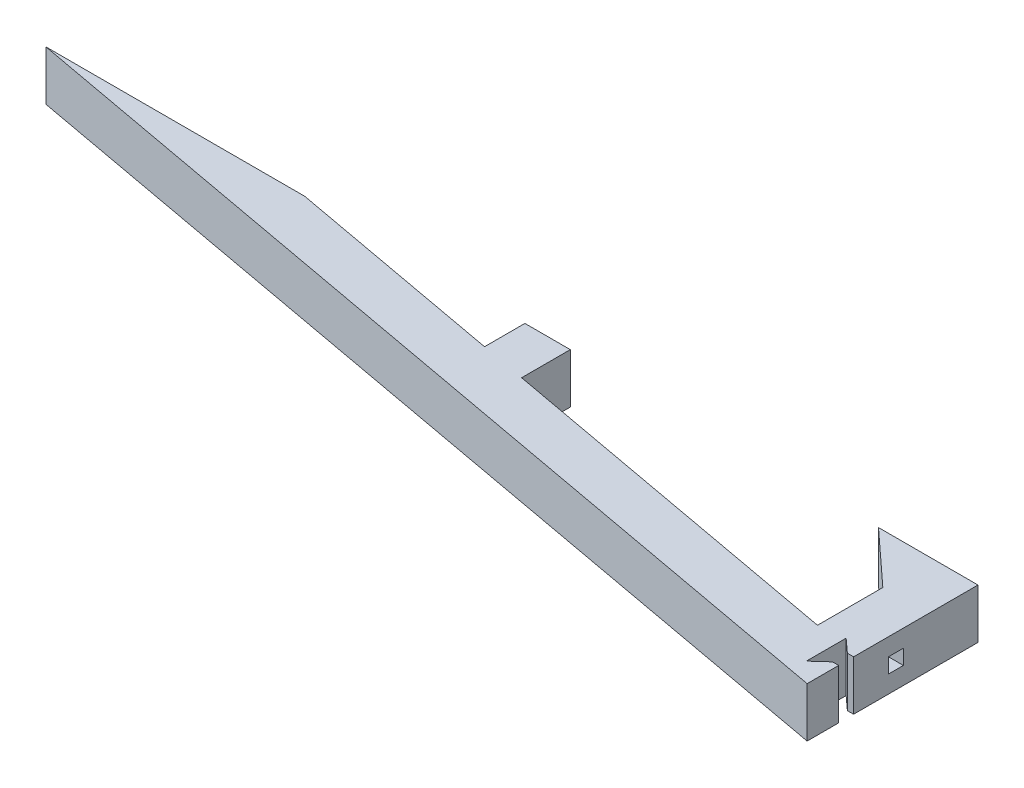
from build123d import *

# Parameters (mm, degrees)
P_IDAT_VYSUNUT_M1_DEPTH  = 8
ODEBRAT_VYSUNUT_M1_DEPTH = 153.557332159
SKICA5_W                 = 16
SKICA5_H                 = 8
P_IDAT_VYSUNUT_M2_DEPTH  = 8
ODEBRAT_VYSUNUT_M4_DEPTH = 153.557332159
SKICA4_W                 = 2.4
SKICA4_H                 = 2.4
ODEBRAT_VYSUNUT_M2_DEPTH = 4.4
SKICA9_R                 = 2.2
ODEBRAT_VYSUNUT_M5_DEPTH = 2.4
SKICA10_R                = 1.85
ODEBRAT_VYSUNUT_M6_DEPTH = 7


with BuildPart() as part:
    # Skica2 → Přidat vysunutím1 (new body)
    with BuildSketch(Plane(origin=(0, 0, 0), x_dir=(1, 0, 0), z_dir=(0, 1, 0))):
        Polygon((0, 0), (0, -27.47211487), (-149.85, 0.000769495), (-108.259653873, 0.000769495), (-72.85, -6.491091207), (-72.85, 0), (-65.55, 0), (-65.55, -7.829443265), (-7.3, -18.508759343), (-7.3, 0), align=None)
    extrude(amount=P_IDAT_VYSUNUT_M1_DEPTH)

    # Skica3 → Odebrat vysunutím1 (cut, through all)
    with BuildSketch(Plane(origin=(0, 8, 0), x_dir=(1, 0, 0), z_dir=(0, 1, 0))):
        Polygon((0, -20), (-1, -20), (-3.2, -18), (-3.2, -24.4), (-1, -22.4), (0, -22.4), align=None)
    extrude(amount=-ODEBRAT_VYSUNUT_M1_DEPTH, mode=Mode.SUBTRACT)

    # Skica5 → Přidat vysunutím2 (add)
    with BuildSketch(Plane(origin=(0, 8, 0), x_dir=(1, 0, 0), z_dir=(0, 1, 0))):
        with Locations((-8, -4)):
            Rectangle(SKICA5_W, SKICA5_H)
    extrude(amount=-P_IDAT_VYSUNUT_M2_DEPTH)

    # Skica7 → Odebrat vysunutím4 (cut, through all)
    with BuildSketch(Plane.XZ):
        Polygon((-7.3, 8), (-16, 8), (-16, 0), align=None)
    extrude(amount=-ODEBRAT_VYSUNUT_M4_DEPTH, mode=Mode.SUBTRACT)

    # Skica4 → Odebrat vysunutím2 (cut)
    with BuildSketch(Plane(origin=(0, 0, 0), x_dir=(0, 0, -1), z_dir=(1, 0, 0))):
        with Locations((-13.2, 4)):
            Rectangle(SKICA4_W, SKICA4_H)
    extrude(amount=-ODEBRAT_VYSUNUT_M2_DEPTH, mode=Mode.SUBTRACT)

    # Skica9 → Odebrat vysunutím5 (cut)
    with BuildSketch(Plane(origin=(0, 0, 0), x_dir=(-1, 0, 0), z_dir=(0, 0, -1))):
        with Locations((3.65, 4)):
            Circle(SKICA9_R)
        with Locations((69.2, 4)):
            Circle(SKICA9_R)
    extrude(amount=-ODEBRAT_VYSUNUT_M5_DEPTH, mode=Mode.SUBTRACT)

    # Skica10 → Odebrat vysunutím6 (cut)
    with BuildSketch(Plane(origin=(0, 0, 2.4), x_dir=(-1, 0, 0), z_dir=(0, 0, -1))):
        with Locations((3.65, 4)):
            Circle(SKICA10_R)
        with Locations((69.2, 4)):
            Circle(SKICA10_R)
    extrude(amount=-ODEBRAT_VYSUNUT_M6_DEPTH, mode=Mode.SUBTRACT)


solid = part.part
